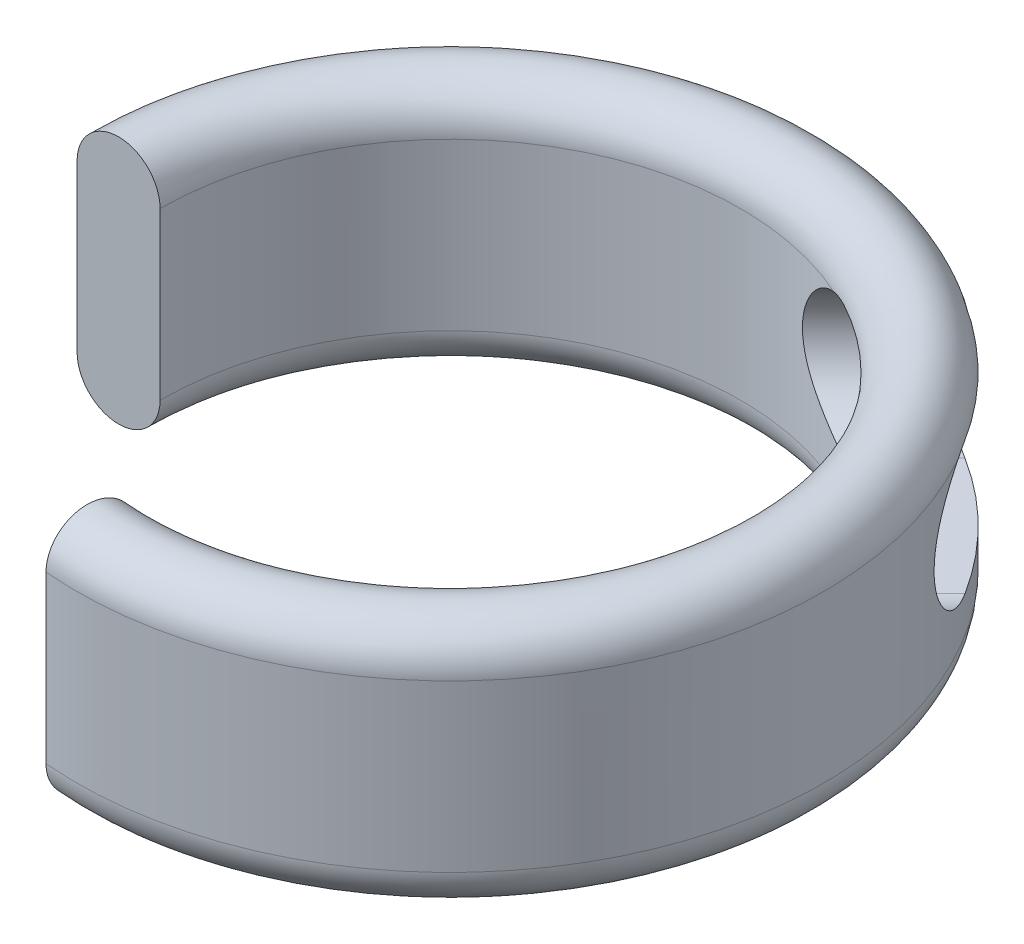
from build123d import *

# Parameters (mm, degrees)
REVOLVE1_ANGLE     = 275
CUT_EXTRUDE1_REACH = 64.273


with BuildPart() as part:
    # Sketch1 → Revolve1 (revolve)
    with BuildSketch(Plane.XY):
        with BuildLine():
            Line((-22.5, -5), (-22.5, 5))
            ThreePointArc((-22.5, 5), (-20, 7.5), (-17.5, 5))
            Line((-17.5, 5), (-17.5, -5))
            ThreePointArc((-17.5, -5), (-20, -7.5), (-22.5, -5))
        make_face()
    revolve(axis=Axis((0, 8.757264849, 0), (0, -1, 0)), revolution_arc=REVOLVE1_ANGLE)

    # Sketch2 → Cut-Extrude1 (cut, up to next)
    with BuildSketch(Plane(origin=(21.213203436, 0, -21.213203436), x_dir=(-0.7071067811865488, 0, -0.7071067811865462), z_dir=(0.7071067811865462, 0, -0.7071067811865488)), mode=Mode.PRIVATE) as cut_extrude1_sk1:
        with BuildLine():
            Line((-5, 5.18337521), (5, 5.18337521))
            ThreePointArc((5, 5.18337521), (9, 1.18337521), (5, -2.81662479))
            Line((5, -2.81662479), (-5, -2.81662479))
            ThreePointArc((-5, -2.81662479), (-9, 1.18337521), (-5, 5.18337521))
        make_face()
    cut_extrude1_tool1 = extrude(cut_extrude1_sk1.sketch, amount=-CUT_EXTRUDE1_REACH, mode=Mode.PRIVATE) & part.part
    add(cut_extrude1_tool1.solids().sort_by_distance((21.213203, 1.183375, -21.213203))[0], mode=Mode.SUBTRACT)


solid = part.part
